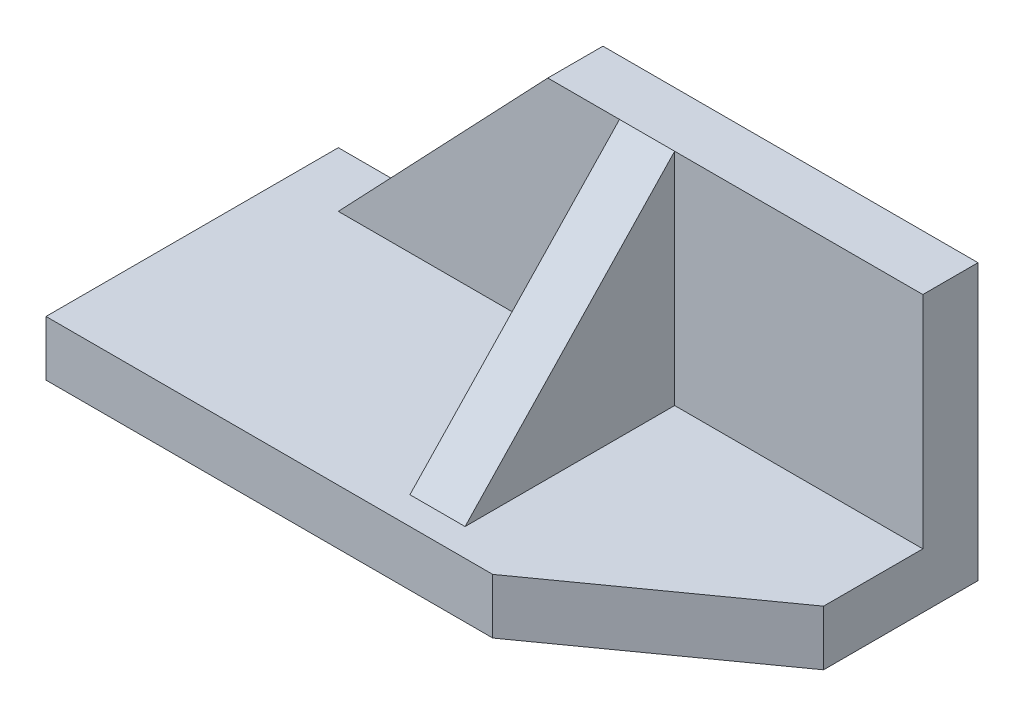
from build123d import *

# Parameters (mm, degrees)
SKETCH2_W           = 81
SKETCH2_H           = 53
BOSS_EXTRUDE1_DEPTH = 10
BOSS_EXTRUDE2_DEPTH = 10
BOSS_EXTRUDE3_DEPTH = 10


with BuildPart() as part:
    # Sketch2 → Boss-Extrude1 (new body)
    with BuildSketch(Plane(origin=(0, 0, 0), x_dir=(1, 0, 0), z_dir=(0, 1, 0))):
        Polygon((77.422904192, 25), (77.422904192, 53), (42.44011976, 53), (42.44011976, 0), align=None)
        with Locations((1.94011976, 26.5)):
            Rectangle(SKETCH2_W, SKETCH2_H)
    extrude(amount=-BOSS_EXTRUDE1_DEPTH)

    # Sketch3 → Boss-Extrude2 (add)
    with BuildSketch(Plane(origin=(0, 0, -53), x_dir=(-1, 0, 0), z_dir=(0, 0, -1))):
        Polygon((-77.422904192, 0), (-77.422904192, 39.932268243), (-9.422904192, 39.932268243), (28.55988024, 0), align=None)
    extrude(amount=-BOSS_EXTRUDE2_DEPTH)

    # Sketch4 → Boss-Extrude3 (add)
    with BuildSketch(Plane(origin=(32.422904192, 0, 0), x_dir=(0, 0, -1), z_dir=(1, 0, 0))):
        Polygon((43, 39.932268243), (5, 0), (43, 0), align=None)
    extrude(amount=-BOSS_EXTRUDE3_DEPTH)


solid = part.part
